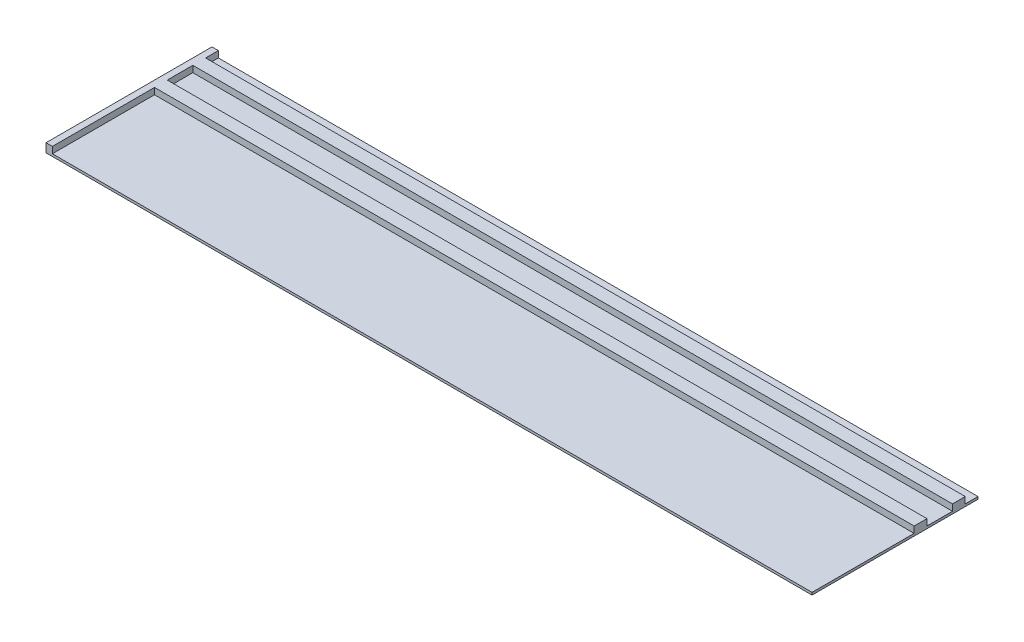
from build123d import *

# Parameters (mm, degrees)
SKETCH1_W           = 762
SKETCH1_H           = 165.1
BOSS_EXTRUDE1_DEPTH = 2.38125
SKETCH2_W           = 762
SKETCH2_H           = 50.8
BOSS_EXTRUDE2_DEPTH = 6.35
SKETCH3_W           = 762
SKETCH3_H           = 25.4
CUT_EXTRUDE1_DEPTH  = 6.35
SKETCH4_W           = 6.35
SKETCH4_H           = 165.1
BOSS_EXTRUDE3_DEPTH = 6.35


with BuildPart() as part:
    # Sketch1 → Boss-Extrude1 (new body)
    with BuildSketch(Plane(origin=(0, 0, 0), x_dir=(1, 0, 0), z_dir=(0, 1, 0))):
        Rectangle(SKETCH1_W, SKETCH1_H)
    extrude(amount=BOSS_EXTRUDE1_DEPTH)

    # Sketch2 → Boss-Extrude2 (add)
    with BuildSketch(Plane(origin=(0, 2.38125, 0), x_dir=(1, 0, 0), z_dir=(0, 1, 0))):
        with Locations((0, 44.45)):
            Rectangle(SKETCH2_W, SKETCH2_H)
    extrude(amount=BOSS_EXTRUDE2_DEPTH)

    # Sketch3 → Cut-Extrude1 (cut)
    with BuildSketch(Plane(origin=(0, 8.73125, 0), x_dir=(1, 0, 0), z_dir=(0, 1, 0))):
        with Locations((0, 44.45)):
            Rectangle(SKETCH3_W, SKETCH3_H)
    extrude(amount=-CUT_EXTRUDE1_DEPTH, mode=Mode.SUBTRACT)

    # Sketch4 → Boss-Extrude3 (add)
    with BuildSketch(Plane(origin=(0, 2.38125, 0), x_dir=(1, 0, 0), z_dir=(0, 1, 0))):
        with Locations((-377.825, 0)):
            Rectangle(SKETCH4_W, SKETCH4_H)
    extrude(amount=BOSS_EXTRUDE3_DEPTH)


solid = part.part
